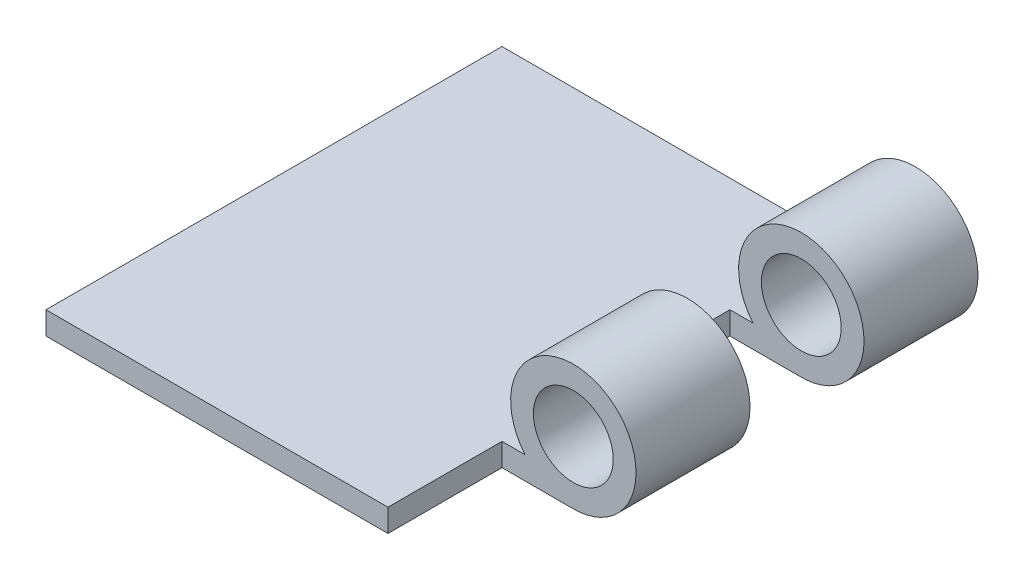
from build123d import *

# Parameters (mm, degrees)
BOSS_EXTRUDE1_DEPTH = 1
SKETCH2_R           = 2.75
SKETCH2_R_2         = 1.75
BOSS_EXTRUDE2_DEPTH = 5
SKETCH3_R           = 2.75
SKETCH3_R_2         = 1.75
BOSS_EXTRUDE3_DEPTH = 5


with BuildPart() as part:
    # Sketch1 → Boss-Extrude1 (new body)
    with BuildSketch(Plane(origin=(0, 0, 0), x_dir=(1, 0, 0), z_dir=(0, 1, 0))):
        Polygon((0, 10), (0, -10), (15, -10), (15, -5), (18, -5), (18, 0), (15, 0), (15, 5), (18, 5), (18, 10), align=None)
    extrude(amount=-BOSS_EXTRUDE1_DEPTH)

    # Sketch2 → Boss-Extrude2 (add)
    with BuildSketch(Plane(origin=(0, 0, -10), x_dir=(-1, 0, 0), z_dir=(0, 0, -1))):
        with Locations((-18.130154704, 1.75)):
            Circle(SKETCH2_R)
        with Locations((-18.130154704, 1.75)):
            Circle(SKETCH2_R_2, mode=Mode.SUBTRACT)
    extrude(amount=-BOSS_EXTRUDE2_DEPTH)

    # Sketch3 → Boss-Extrude3 (add)
    with BuildSketch(Plane(origin=(0, 0, 0), x_dir=(-1, 0, 0), z_dir=(0, 0, -1))):
        with Locations((-18.130154704, 1.75)):
            Circle(SKETCH3_R)
        with Locations((-18.130154704, 1.75)):
            Circle(SKETCH3_R_2, mode=Mode.SUBTRACT)
    extrude(amount=-BOSS_EXTRUDE3_DEPTH)


solid = part.part
